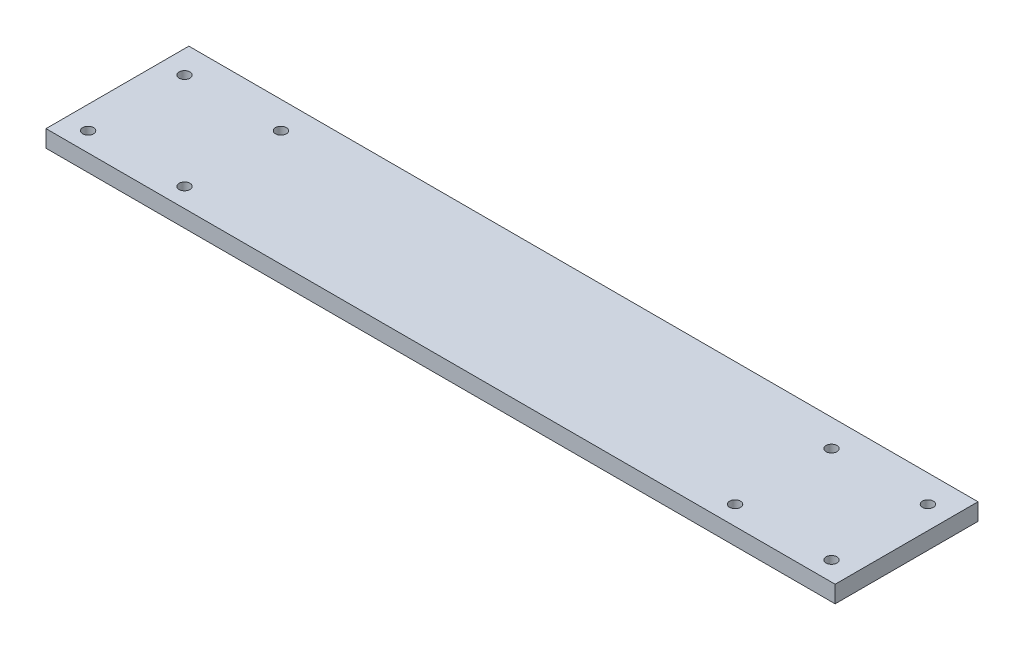
from build123d import *

# Parameters (mm, degrees)
SKETCH1_W           = 147.32
SKETCH1_H           = 26.67
SKETCH1_R           = 1.016
BOSS_EXTRUDE1_DEPTH = 3.175


with BuildPart() as part:
    # Sketch1 → Boss-Extrude1 (new body)
    with BuildSketch(Plane(origin=(0, 0, 0), x_dir=(1, 0, 0), z_dir=(0, 1, 0))):
        with Locations((0, 13.335)):
            Rectangle(SKETCH1_W, SKETCH1_H)
        with Locations(Location((51.3885, 21.59, 0), (0, 0, 270))):
            Circle(SKETCH1_R, mode=Mode.SUBTRACT)
        with Locations(Location((69.3885, 21.59, 0), (0, 0, 270))):
            Circle(SKETCH1_R, mode=Mode.SUBTRACT)
        with Locations(Location((51.3885, 3.59, 0), (0, 0, 270))):
            Circle(SKETCH1_R, mode=Mode.SUBTRACT)
        with Locations(Location((69.3885, 3.59, 0), (0, 0, 270))):
            Circle(SKETCH1_R, mode=Mode.SUBTRACT)
        with Locations(Location((-69.3885, 3.59, 0), (0, 0, 90))):
            Circle(SKETCH1_R, mode=Mode.SUBTRACT)
        with Locations(Location((-51.3885, 3.59, 0), (0, 0, 90))):
            Circle(SKETCH1_R, mode=Mode.SUBTRACT)
        with Locations(Location((-69.3885, 21.59, 0), (0, 0, 90))):
            Circle(SKETCH1_R, mode=Mode.SUBTRACT)
        with Locations(Location((-51.3885, 21.59, 0), (0, 0, 90))):
            Circle(SKETCH1_R, mode=Mode.SUBTRACT)
    extrude(amount=BOSS_EXTRUDE1_DEPTH)


solid = part.part
